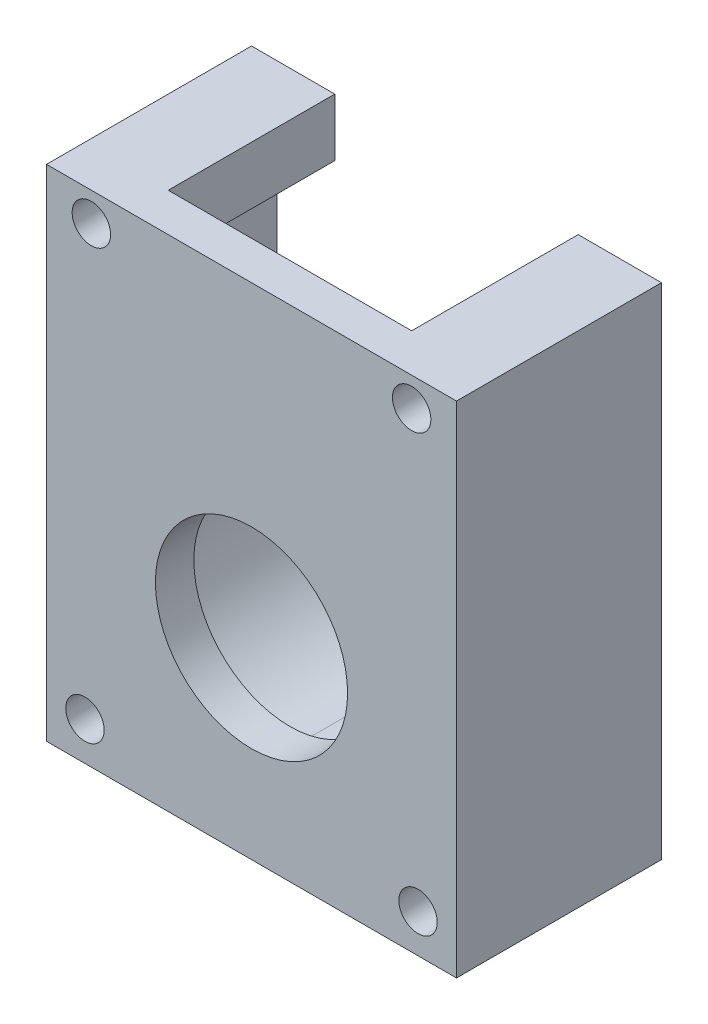
from build123d import *

# Parameters (mm, degrees)
BOSS_EXTRUDE1_DEPTH = 19
SKETCH2_W           = 4.5
SKETCH2_H           = 4.5
BOSS_EXTRUDE2_DEPTH = 19
FILLET1_R           = 10
FILLET2_R           = 10
FILLET3_R           = 1
SKETCH3_R           = 1.5
CUT_EXTRUDE1_DEPTH  = 19
SKETCH4_W           = 32
SKETCH4_H           = 3
CUT_EXTRUDE2_DEPTH  = 47.238512087
SKETCH5_W           = 32
SKETCH5_H           = 39
SKETCH5_R           = 1.5
BOSS_EXTRUDE3_DEPTH = 3
SKETCH6_R           = 7.5
CUT_EXTRUDE3_DEPTH  = 33.984845005


with BuildPart() as part:
    # Sketch1 → Boss-Extrude1 (new body)
    with BuildSketch(Plane.XY):
        with BuildLine():
            Line((-16, 24), (-16, 0))
            ThreePointArc((-16, 0), (-15.491933385, 4), (-14, 7.745966692))
            Line((-14, 7.745966692), (-14, 22))
            Line((-14, 22), (-14, 24))
            Line((-14, 24), (-16, 24))
        make_face()
        with BuildLine():
            ThreePointArc((-14, 7.745966692), (-15.491933385, 4), (-16, 0))
            ThreePointArc((-16, 0), (-15.491933385, -4), (-14, -7.745966692))
            Line((-14, -7.745966692), (-14, 0))
            Line((-14, 0), (-14, 7.745966692))
        make_face()
        with BuildLine():
            ThreePointArc((-14, -7.745966692), (-15.491933385, -4), (-16, 0))
            Line((-16, 0), (-16, -15))
            Line((-16, -15), (-5.567764363, -15))
            ThreePointArc((-5.567764363, -15), (-7.514407784, -14.125638947), (-9.327379053, -13))
            Line((-9.327379053, -13), (-14, -13))
            Line((-14, -13), (-14, -7.745966692))
        make_face()
        with BuildLine():
            ThreePointArc((-9.327379053, -13), (-7.514407784, -14.125638947), (-5.567764363, -15))
            Line((-5.567764363, -15), (5.567764363, -15))
            ThreePointArc((5.567764363, -15), (7.514407784, -14.125638947), (9.327379053, -13))
            Line((9.327379053, -13), (5.196152423, -13))
            ThreePointArc((5.196152423, -13), (0, -14), (-5.196152423, -13))
            Line((-5.196152423, -13), (-9.327379053, -13))
        make_face()
        with BuildLine():
            Line((5.196152423, -13), (-5.196152423, -13))
            ThreePointArc((-5.196152423, -13), (0, -14), (5.196152423, -13))
        make_face()
        with BuildLine():
            ThreePointArc((9.327379053, -13), (7.514407784, -14.125638947), (5.567764363, -15))
            Line((5.567764363, -15), (16, -15))
            Line((16, -15), (16, 0))
            ThreePointArc((16, 0), (15.491933385, -4), (14, -7.745966692))
            Line((14, -7.745966692), (14, -13))
            Line((14, -13), (9.327379053, -13))
        make_face()
        with BuildLine():
            ThreePointArc((16, 0), (15.491933385, 4), (14, 7.745966692))
            Line((14, 7.745966692), (14, 0))
            Line((14, 0), (14, -7.745966692))
            ThreePointArc((14, -7.745966692), (15.491933385, -4), (16, 0))
        make_face()
        with BuildLine():
            Line((14, 22), (14, 7.745966692))
            ThreePointArc((14, 7.745966692), (15.491933385, 4), (16, 0))
            Line((16, 0), (16, 24))
            Line((16, 24), (14, 24))
            Line((14, 24), (14, 22))
        make_face()
    extrude(amount=BOSS_EXTRUDE1_DEPTH)

    # Sketch2 → Boss-Extrude2 (add)
    with BuildSketch(Plane.XY.offset(19)):
        with Locations((-11.75, 21.75)):
            Rectangle(SKETCH2_W, SKETCH2_H)
        with Locations((11.75, 21.75)):
            Rectangle(SKETCH2_W, SKETCH2_H)
    extrude(amount=-BOSS_EXTRUDE2_DEPTH)

    # Fillet1
    fillet1_edges = [part.edges().sort_by_distance(p)[0] for p in [
        (-14, -13, 9.5),
    ]]
    fillet(fillet1_edges, radius=FILLET1_R)

    # Fillet2
    fillet2_edges = [part.edges().sort_by_distance(p)[0] for p in [
        (14, -13, 9.5),
    ]]
    fillet(fillet2_edges, radius=FILLET2_R)

    # Fillet3
    fillet3_edges = [part.edges().sort_by_distance(p)[0] for p in [
        (-14, 19.5, 9.5),
        (14, 19.5, 9.5),
    ]]
    fillet(fillet3_edges, radius=FILLET3_R)

    # Sketch3 → Cut-Extrude1 (cut)
    with BuildSketch(Plane.XY.offset(19)):
        with Locations((-12.5, 21.75)):
            Circle(SKETCH3_R)
        with Locations((-13, -12)):
            Circle(SKETCH3_R)
        with Locations(Location((12.5, 21.75, 0), (0, 0, 180))):
            Circle(SKETCH3_R)
        with Locations(Location((13, -12, 0), (0, 0, 180))):
            Circle(SKETCH3_R)
    extrude(amount=-CUT_EXTRUDE1_DEPTH, mode=Mode.SUBTRACT)

    # Sketch4 → Cut-Extrude2 (cut, through all)
    with BuildSketch(Plane(origin=(0, 24, 0), x_dir=(1, 0, 0), z_dir=(0, 1, 0))):
        with Locations((0, -17.5)):
            Rectangle(SKETCH4_W, SKETCH4_H)
    extrude(amount=-CUT_EXTRUDE2_DEPTH, mode=Mode.SUBTRACT)

    # Sketch5 → Boss-Extrude3 (add)
    with BuildSketch(Plane.XY.offset(16)):
        with Locations((0, 4.5)):
            Rectangle(SKETCH5_W, SKETCH5_H)
        with Locations((-12.5, 21.75)):
            Circle(SKETCH5_R, mode=Mode.SUBTRACT)
        with Locations(Location((12.5, 21.75, 0), (0, 0, 180))):
            Circle(SKETCH5_R, mode=Mode.SUBTRACT)
        with Locations((-13, -12)):
            Circle(SKETCH5_R, mode=Mode.SUBTRACT)
        with Locations(Location((13, -12, 0), (0, 0, 180))):
            Circle(SKETCH5_R, mode=Mode.SUBTRACT)
    extrude(amount=-BOSS_EXTRUDE3_DEPTH)

    # Sketch6 → Cut-Extrude3 (cut, through all)
    with BuildSketch(Plane.XY.offset(16)):
        Circle(SKETCH6_R)
    extrude(amount=-CUT_EXTRUDE3_DEPTH, mode=Mode.SUBTRACT)


solid = part.part
